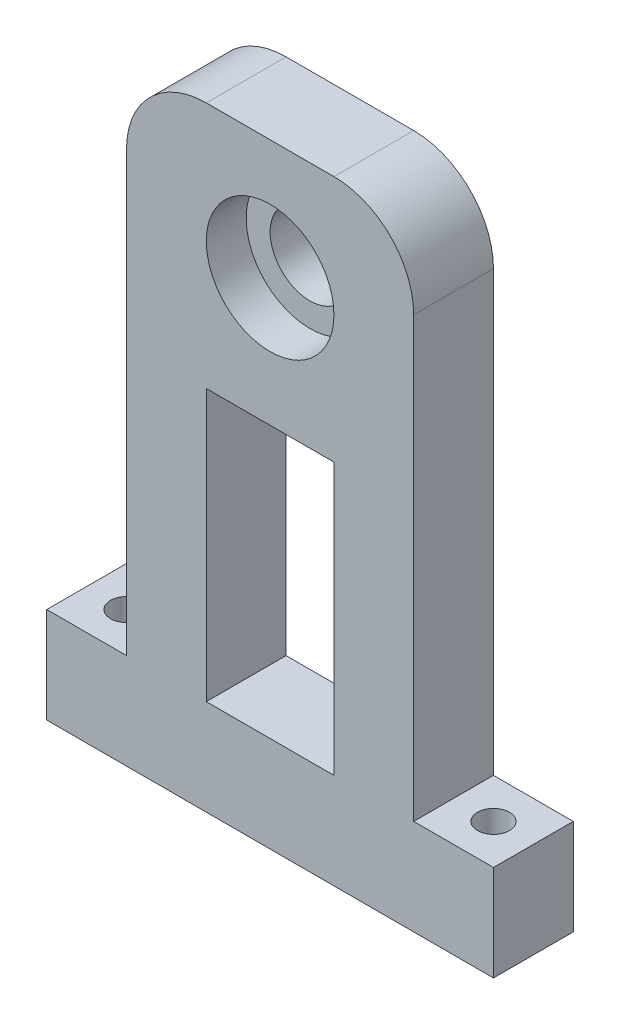
from build123d import *

# Parameters (mm, degrees)
BOSS_EXTRUDE1_DEPTH = 10
SKETCH2_R           = 8
CUT_EXTRUDE1_DEPTH  = 5
FILLET1_R           = 10
SKETCH4_R           = 2
CUT_EXTRUDE3_DEPTH  = 22
SKETCH5_R           = 2
CUT_EXTRUDE4_DEPTH  = 23
SKETCH6_R           = 5
CUT_EXTRUDE5_DEPTH  = 10
SKETCH8_W           = 16
SKETCH8_H           = 34
CUT_EXTRUDE7_DEPTH  = 10


with BuildPart() as part:
    # Sketch1 → Boss-Extrude1 (new body)
    with BuildSketch(Plane.XY):
        Polygon((-37.625, -24), (18.375, -24), (18.375, -12), (8.375, -12), (8.375, 53), (-27.625, 53), (-27.625, -12), (-37.625, -12), align=None)
    extrude(amount=BOSS_EXTRUDE1_DEPTH)

    # Sketch2 → Cut-Extrude1 (cut)
    with BuildSketch(Plane.XY.offset(10)):
        with Locations((-9.625, 38)):
            Circle(SKETCH2_R)
    extrude(amount=-CUT_EXTRUDE1_DEPTH, mode=Mode.SUBTRACT)

    # Fillet1
    fillet1_edges = [part.edges().sort_by_distance(p)[0] for p in [
        (-27.625, 53, 5),
        (8.375, 53, 5),
    ]]
    fillet(fillet1_edges, radius=FILLET1_R)

    # Sketch4 → Cut-Extrude3 (cut)
    with BuildSketch(Plane(origin=(0, -12, 0), x_dir=(1, 0, 0), z_dir=(0, 1, 0))):
        with Locations((13.375, -5)):
            Circle(SKETCH4_R)
    extrude(amount=-CUT_EXTRUDE3_DEPTH, mode=Mode.SUBTRACT)

    # Sketch5 → Cut-Extrude4 (cut)
    with BuildSketch(Plane(origin=(0, -12, 0), x_dir=(1, 0, 0), z_dir=(0, 1, 0))):
        with Locations((-32.625, -5)):
            Circle(SKETCH5_R)
    extrude(amount=-CUT_EXTRUDE4_DEPTH, mode=Mode.SUBTRACT)

    # Sketch6 → Cut-Extrude5 (cut)
    with BuildSketch(Plane.XY.offset(5)):
        with Locations((-9.625, 38)):
            Circle(SKETCH6_R)
    extrude(amount=-CUT_EXTRUDE5_DEPTH, mode=Mode.SUBTRACT)

    # Sketch8 → Cut-Extrude7 (cut)
    with BuildSketch(Plane.XY.offset(10)):
        with Locations((-9.625, 5)):
            Rectangle(SKETCH8_W, SKETCH8_H)
    extrude(amount=-CUT_EXTRUDE7_DEPTH, mode=Mode.SUBTRACT)


solid = part.part
